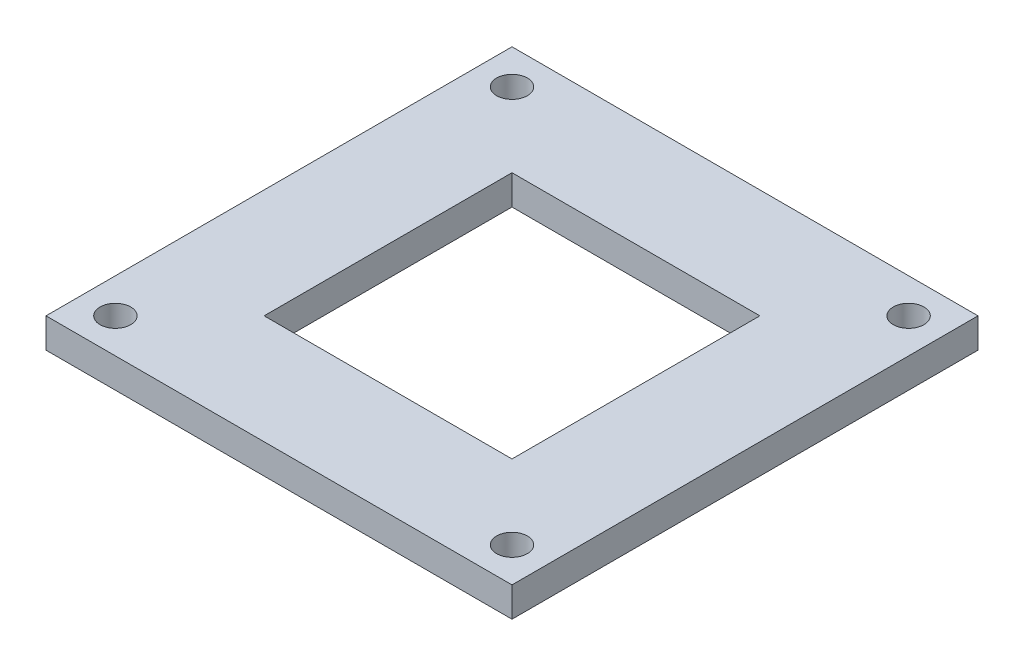
from build123d import *

# Parameters (mm, degrees)
SKETCH_1_W          = 47
SKETCH_1_H          = 47
EXTRUDE_1_DEPTH     = 3
SKETCH_2_W          = 25
SKETCH_2_H          = 25
CUT_EXTRUDE_1_DEPTH = 3
SKETCH_3_R          = 1.55
CUT_EXTRUDE_2_DEPTH = 3


with BuildPart() as part:
    # 草图1 → 凸台-拉伸1 (new body)
    with BuildSketch(Plane(origin=(0, 0, 0), x_dir=(1, 0, 0), z_dir=(0, 1, 0))):
        Rectangle(SKETCH_1_W, SKETCH_1_H)
    extrude(amount=EXTRUDE_1_DEPTH)

    # 草图2 → 切除-拉伸1 (cut)
    with BuildSketch(Plane(origin=(0, 3, 0), x_dir=(1, 0, 0), z_dir=(0, 1, 0))):
        Rectangle(SKETCH_2_W, SKETCH_2_H)
    extrude(amount=-CUT_EXTRUDE_1_DEPTH, mode=Mode.SUBTRACT)

    # 草图3 → 切除-拉伸2 (cut)
    with BuildSketch(Plane.XZ):
        with Locations(Location((20, 20, 0), (0, 0, 270))):
            Circle(SKETCH_3_R)
        with Locations(Location((-20, 20, 0), (0, 0, 90))):
            Circle(SKETCH_3_R)
        with Locations(Location((20, -20, 0), (0, 0, 90))):
            Circle(SKETCH_3_R)
        with Locations(Location((-20, -20, 0), (0, 0, 270))):
            Circle(SKETCH_3_R)
    extrude(amount=-CUT_EXTRUDE_2_DEPTH, mode=Mode.SUBTRACT)


solid = part.part
